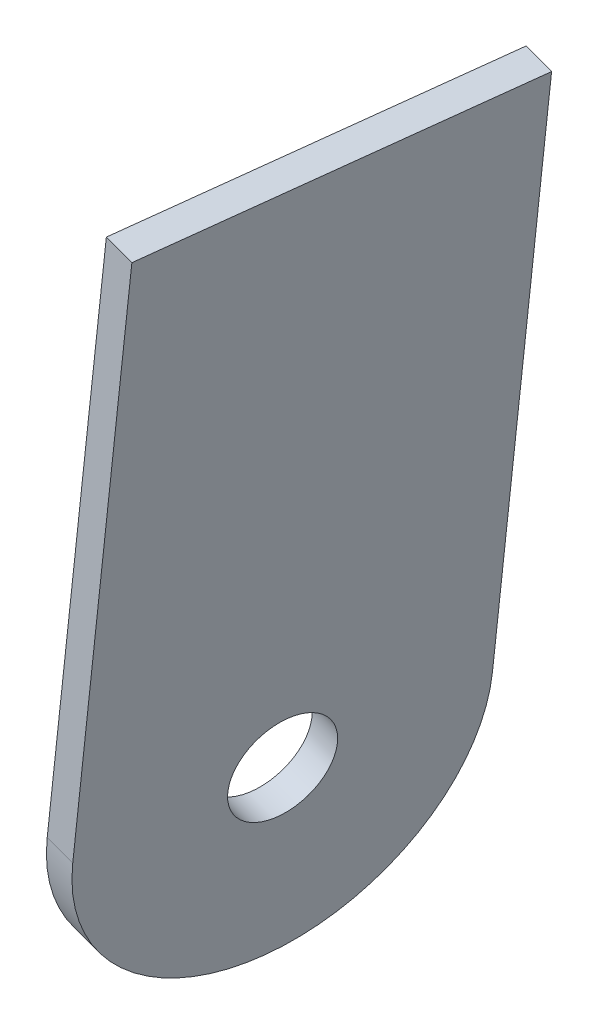
from build123d import *

# Parameters (mm, degrees)
SKETCH2_R           = 2.4892
BOSS_EXTRUDE1_DEPTH = 1.5875


with BuildPart() as part:
    # Sketch2 → Boss-Extrude1 (new body)
    with BuildSketch(Plane(origin=(-406.434347041, 66.988247001, -60.080441698), x_dir=(-0.14240696456357832, 0.02347142407205886, 0.9895298624578327), z_dir=(-0.9763571476802022, 0.16092255550294132, -0.1443282761768555))):
        with BuildLine():
            Line((-544.785785419, 305.655391385), (-546.457439277, 275.221266239))
            ThreePointArc((-546.457439277, 275.221266239), (-537.469166999, 265.1882103), (-527.436111061, 274.176482578))
            Line((-527.436111061, 274.176482578), (-525.764457203, 304.610607723))
            Line((-525.764457203, 304.610607723), (-544.785785419, 305.655391385))
        make_face()
        with Locations(Location((-536.946775169, 274.698874408, 0), (0, 0, 270))):
            Circle(SKETCH2_R, mode=Mode.SUBTRACT)
    extrude(amount=BOSS_EXTRUDE1_DEPTH)


solid = part.part
